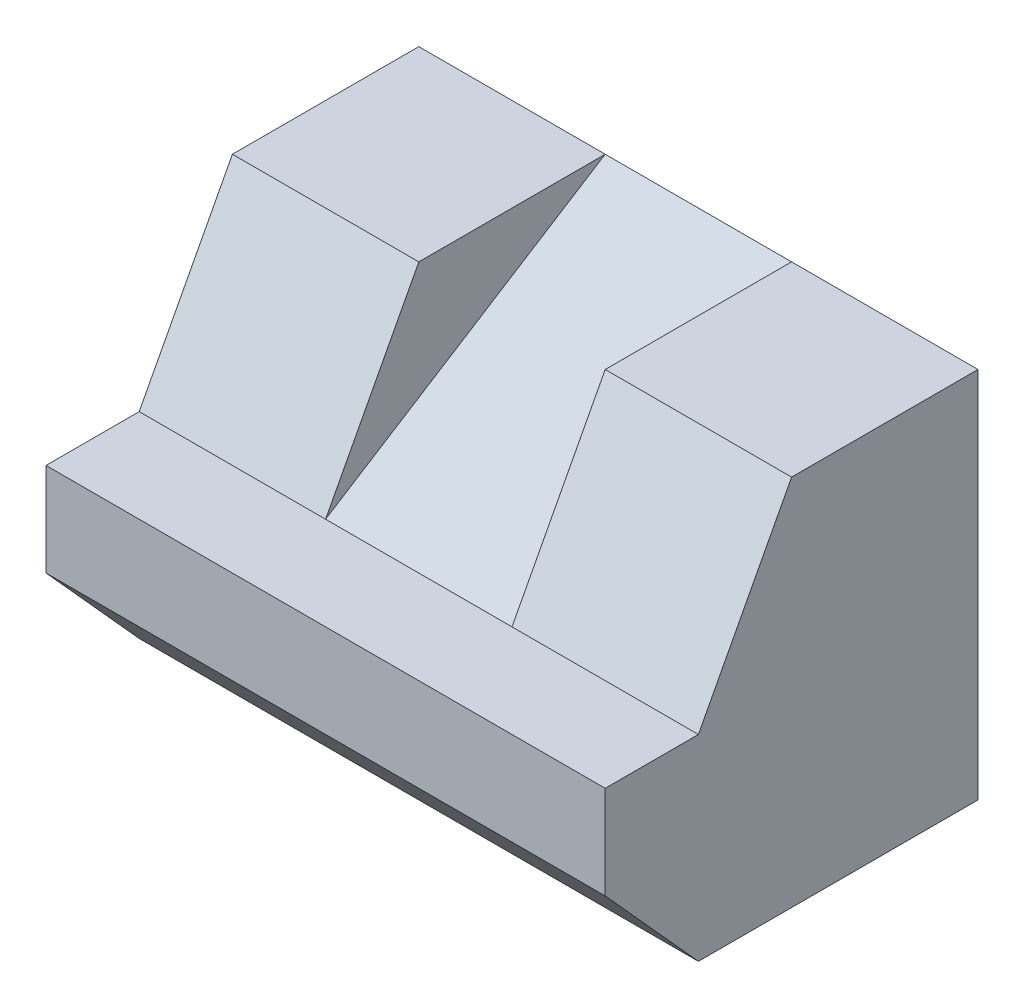
from build123d import *

# Parameters (mm, degrees)
SALIENTE_EXTRUIR1_DEPTH = 76.2
CORTAR_EXTRUIR1_START   = -25.4
CORTAR_EXTRUIR1_DEPTH   = 25.4


with BuildPart() as part:
    # Croquis1 → Saliente-Extruir1 (new body)
    with BuildSketch(Plane(origin=(0, 0, 0), x_dir=(0, 0, -1), z_dir=(1, 0, 0))):
        Polygon((0, 0), (0, 50.8), (-25.4, 50.8), (-38.1, 26.775876844), (-50.8, 26.775876844), (-50.8, 14.075876844), (-38.1, 0), align=None)
    extrude(amount=SALIENTE_EXTRUIR1_DEPTH)

    # Croquis2 → Cortar-Extruir1 (cut)
    with BuildSketch(Plane(origin=(76.2, 0, 0), x_dir=(0, 0, -1), z_dir=(1, 0, 0)).offset(CORTAR_EXTRUIR1_START)):
        Polygon((-38.1, 26.775876844), (0, 50.8), (-25.4, 50.8), align=None)
    extrude(amount=-CORTAR_EXTRUIR1_DEPTH, mode=Mode.SUBTRACT)


solid = part.part
